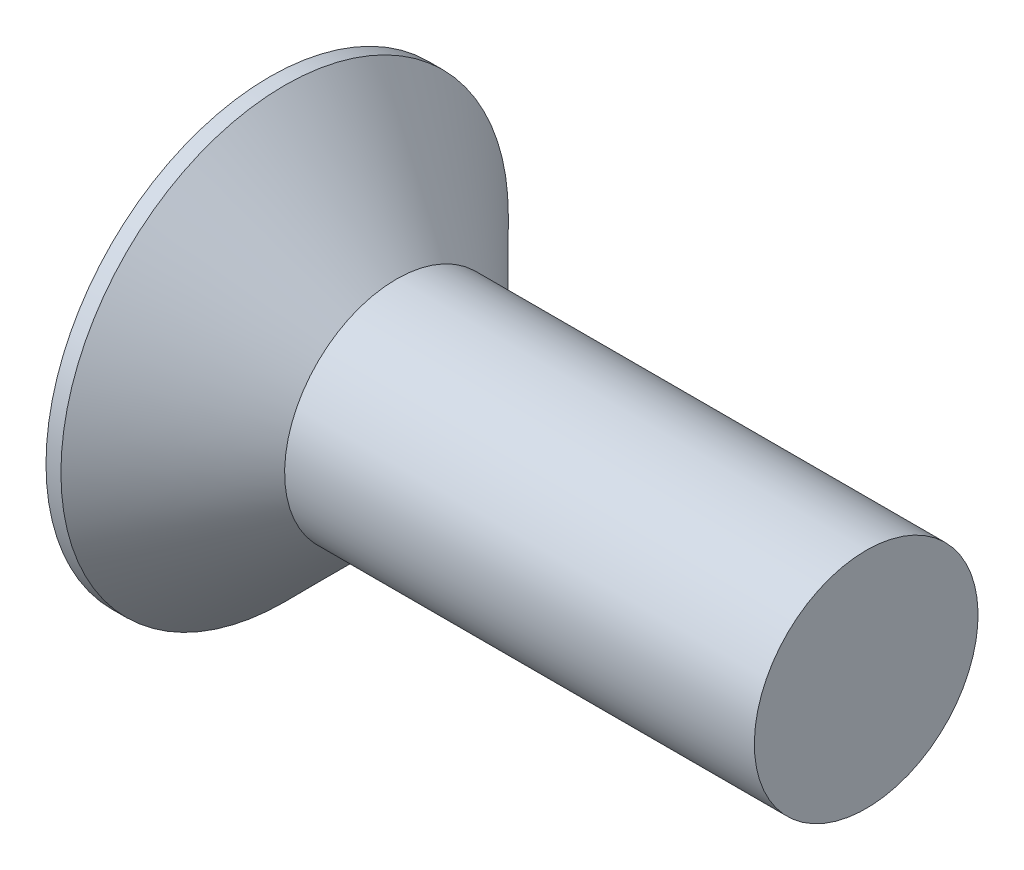
from build123d import *


with BuildPart() as part:
    # Skica1 → Rotovat1 (revolve)
    with BuildSketch(Plane.XY, mode=Mode.PRIVATE) as rotovat1_sk:
        Polygon((0, 0), (0, -3), (0.2, -3), (1.7, -1.5), (8, -1.5), (8, 0), align=None)
    revolve(rotovat1_sk.sketch.rotate(Axis((0, 0, 0), (-1, 0, 0)), 180), axis=Axis((0, 0, 0), (-1, 0, 0)))


solid = part.part
